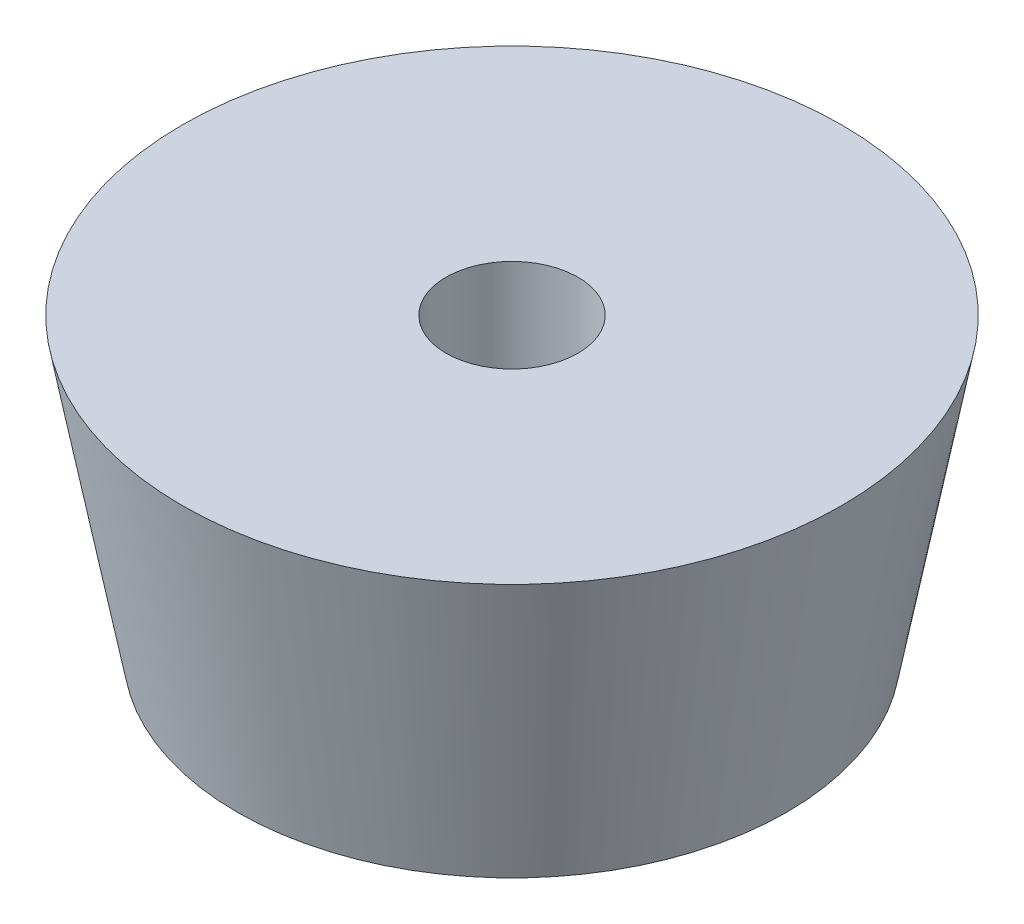
from build123d import *


with BuildPart() as part:
    # Sketch1 → Revolve1 (revolve)
    with BuildSketch(Plane.XY, mode=Mode.PRIVATE) as revolve1_sk:
        Polygon((-4, 0), (-4, 4), (-1.8, 4), (-1.8, 8), (-9, 8), (-7.5, 0), align=None)
    revolve(revolve1_sk.sketch.rotate(Axis((0, 0, 0), (0, 1, 0)), 180), axis=Axis((0, 0, 0), (0, 1, 0)))


solid = part.part
